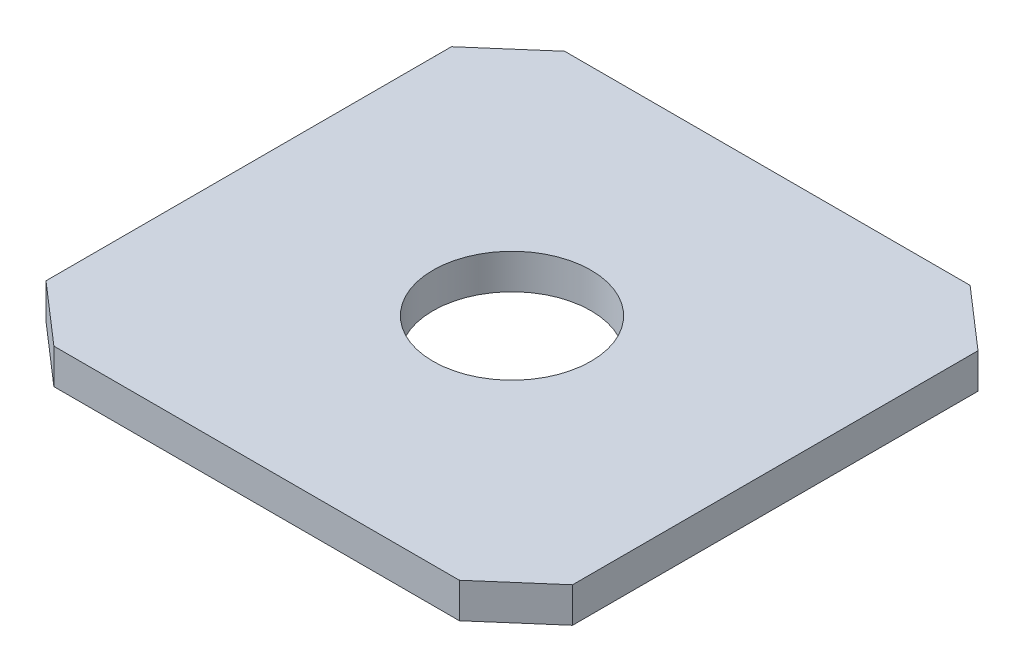
from build123d import *

# Parameters (mm, degrees)
BOSS_EXTRUDE1_DEPTH = 2
SKETCH2_R           = 4.5
CUT_EXTRUDE1_DEPTH  = 31.296192101


with BuildPart() as part:
    # Sketch1 → Boss-Extrude1 (new body)
    with BuildSketch(Plane(origin=(0, 0, 0), x_dir=(1, 0, 0), z_dir=(0, 1, 0))):
        Polygon((-10.147286186, 19.79756588), (-10.147286186, -3.30243412), (-6.697286186, -6.30243412), (16.402713814, -6.30243412), (19.852713814, -3.30243412), (19.852713814, 19.79756588), (16.402713814, 22.79756588), (-6.697286186, 22.79756588), align=None)
    extrude(amount=BOSS_EXTRUDE1_DEPTH)

    # Sketch2 → Cut-Extrude1 (cut, through all)
    with BuildSketch(Plane(origin=(0, 2, 0), x_dir=(1, 0, 0), z_dir=(0, 1, 0))):
        with Locations(Location((4.852713814, 8.24756588, 0), (0, 0, 270))):
            Circle(SKETCH2_R)
    extrude(amount=-CUT_EXTRUDE1_DEPTH, mode=Mode.SUBTRACT)


solid = part.part
